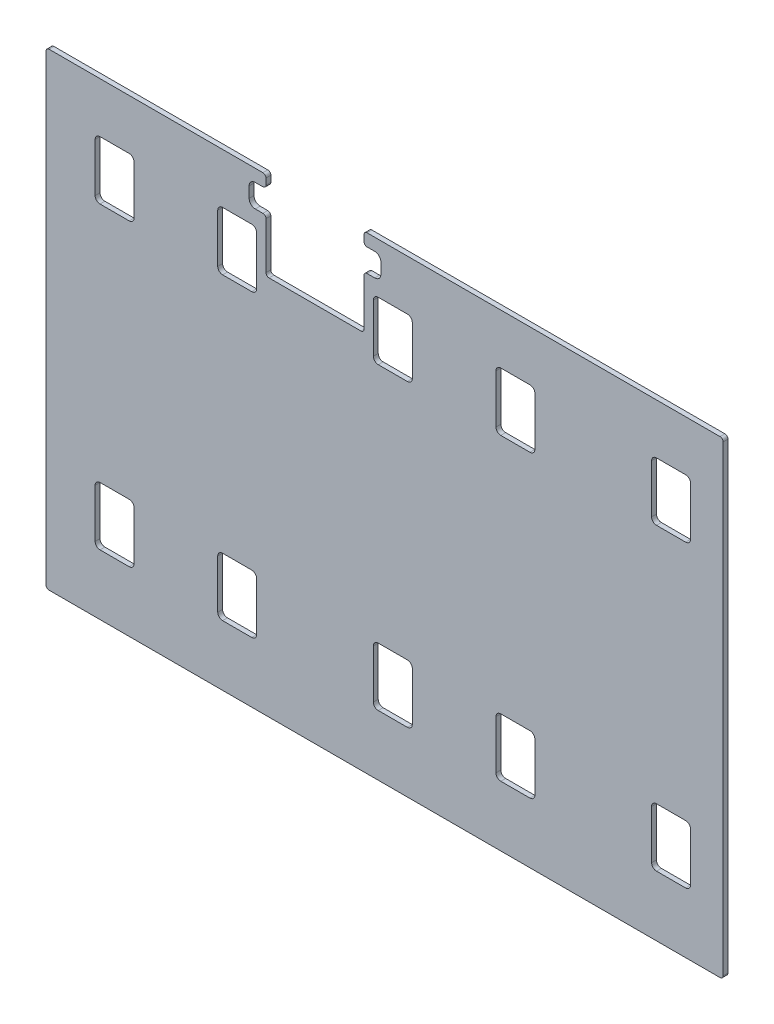
from build123d import *

# Parameters (mm, degrees)
SKETCH1_W           = 441.979400076
SKETCH1_H           = 305.81676
BOSS_EXTRUDE1_DEPTH = 3.175
CUT_EXTRUDE1_DEPTH  = 271.654843319
CUT_EXTRUDE2_DEPTH  = 271.654843319
LPATTERN1_COUNT     = 3
LPATTERN1_PITCH     = 181.613999992
LPATTERN2_COUNT     = 2
LPATTERN2_PITCH     = 181.613999992
CUT_EXTRUDE3_DEPTH  = 271.654843319
FILLET1_R           = 2


with BuildPart() as part:
    # Sketch1 → Boss-Extrude1 (new body)
    with BuildSketch(Plane.XY):
        with Locations((0, -3.32067)):
            Rectangle(SKETCH1_W, SKETCH1_H)
    extrude(amount=BOSS_EXTRUDE1_DEPTH)

    # Sketch2 → Cut-Extrude1 (cut, through all)
    with BuildSketch(Plane.XY.offset(3.175)):
        with BuildLine():
            Line((-166.696625, 116.8), (-185.746625, 116.8))
            ThreePointArc((-185.746625, 116.8), (-187.99168903, 115.87006403), (-188.921625, 113.625))
            Line((-188.921625, 113.625), (-188.921625, 81.875))
            ThreePointArc((-188.921625, 81.875), (-187.99168903, 79.62993597), (-185.746625, 78.7))
            Line((-185.746625, 78.7), (-166.696625, 78.7))
            ThreePointArc((-166.696625, 78.7), (-164.45156097, 79.62993597), (-163.521625, 81.875))
            Line((-163.521625, 81.875), (-163.521625, 113.625))
            ThreePointArc((-163.521625, 113.625), (-164.45156097, 115.87006403), (-166.696625, 116.8))
        make_face()
        with BuildLine():
            Line((-166.696625, -78.7), (-185.746625, -78.7))
            ThreePointArc((-185.746625, -78.7), (-187.99168903, -79.62993597), (-188.921625, -81.875))
            Line((-188.921625, -81.875), (-188.921625, -113.625))
            ThreePointArc((-188.921625, -113.625), (-187.99168903, -115.87006403), (-185.746625, -116.8))
            Line((-185.746625, -116.8), (-166.696625, -116.8))
            ThreePointArc((-166.696625, -116.8), (-164.45156097, -115.87006403), (-163.521625, -113.625))
            Line((-163.521625, -113.625), (-163.521625, -81.875))
            ThreePointArc((-163.521625, -81.875), (-164.45156097, -79.62993597), (-166.696625, -78.7))
        make_face()
    cut_extrude1 = extrude(amount=-CUT_EXTRUDE1_DEPTH, mode=Mode.SUBTRACT)

    # Sketch3 → Cut-Extrude2 (cut, through all)
    with BuildSketch(Plane.XY.offset(3.175)):
        with BuildLine():
            ThreePointArc((-83.506375, 113.625), (-84.43631097, 115.87006403), (-86.681375, 116.8))
            Line((-86.681375, 116.8), (-105.731375, 116.8))
            ThreePointArc((-105.731375, 116.8), (-107.97643903, 115.87006403), (-108.906375, 113.625))
            Line((-108.906375, 113.625), (-108.906375, 81.875))
            ThreePointArc((-108.906375, 81.875), (-107.97643903, 79.62993597), (-105.731375, 78.7))
            Line((-105.731375, 78.7), (-86.681375, 78.7))
            ThreePointArc((-86.681375, 78.7), (-84.43631097, 79.62993597), (-83.506375, 81.875))
            Line((-83.506375, 81.875), (-83.506375, 113.625))
        make_face()
        with BuildLine():
            ThreePointArc((-108.906375, -113.625), (-107.97643903, -115.87006403), (-105.731375, -116.8))
            Line((-105.731375, -116.8), (-86.681375, -116.8))
            ThreePointArc((-86.681375, -116.8), (-84.43631097, -115.87006403), (-83.506375, -113.625))
            Line((-83.506375, -113.625), (-83.506375, -81.875))
            ThreePointArc((-83.506375, -81.875), (-84.43631097, -79.62993597), (-86.681375, -78.7))
            Line((-86.681375, -78.7), (-105.731375, -78.7))
            ThreePointArc((-105.731375, -78.7), (-107.97643903, -79.62993597), (-108.906375, -81.875))
            Line((-108.906375, -81.875), (-108.906375, -113.625))
        make_face()
    cut_extrude2 = extrude(amount=-CUT_EXTRUDE2_DEPTH, mode=Mode.SUBTRACT)

    # LPattern1: Cut-Extrude1 ×3
    with Locations(*[(i * LPATTERN1_PITCH, 0, 0) for i in range(1, LPATTERN1_COUNT)]):
        add(cut_extrude1, mode=Mode.SUBTRACT)

    # LPattern2: Cut-Extrude2 ×2
    with Locations(*[(i * LPATTERN2_PITCH, 0, 0) for i in range(1, LPATTERN2_COUNT)]):
        add(cut_extrude2, mode=Mode.SUBTRACT)

    # Sketch6 → Cut-Extrude3 (cut, through all)
    with BuildSketch(Plane.XY.offset(3.175)):
        with BuildLine():
            Line((-77.407000004, 92.08771), (-13.407000004, 92.08771))
            Line((-13.407000004, 92.08771), (-13.407000004, 126.58771))
            Line((-13.407000004, 126.58771), (-6.407000004, 126.58771))
            ThreePointArc((-6.407000004, 126.58771), (-3.578572879, 127.759282875), (-2.407000004, 130.58771))
            Line((-2.407000004, 130.58771), (-2.407000004, 137.58771))
            ThreePointArc((-2.407000004, 137.58771), (-3.578572879, 140.416137125), (-6.407000004, 141.58771))
            Line((-6.407000004, 141.58771), (-13.407000004, 141.58771))
            Line((-13.407000004, 141.58771), (-13.407000004, 149.58771))
            Line((-13.407000004, 149.58771), (-77.407000004, 149.58771))
            Line((-77.407000004, 149.58771), (-77.407000004, 141.58771))
            Line((-77.407000004, 141.58771), (-84.407000004, 141.58771))
            ThreePointArc((-84.407000004, 141.58771), (-87.235427129, 140.416137125), (-88.407000004, 137.58771))
            Line((-88.407000004, 137.58771), (-88.407000004, 130.58771))
            ThreePointArc((-88.407000004, 130.58771), (-87.235427129, 127.759282875), (-84.407000004, 126.58771))
            Line((-84.407000004, 126.58771), (-77.407000004, 126.58771))
            Line((-77.407000004, 126.58771), (-77.407000004, 92.08771))
        make_face()
    extrude(amount=-CUT_EXTRUDE3_DEPTH, mode=Mode.SUBTRACT)

    # Fillet1
    fillet1_edges = [part.edges().sort_by_distance(p)[0] for p in [
        (-13.407000004, 126.58771, 1.5875),
        (-13.407000004, 92.08771, 1.5875),
        (-77.407000004, 92.08771, 1.5875),
        (-77.407000004, 126.58771, 1.5875),
        (-13.407000004, 141.58771, 1.5875),
        (-77.407000004, 141.58771, 1.5875),
        (-13.407000004, 149.58771, 1.5875),
        (-77.407000004, 149.58771, 1.5875),
        (220.989700038, 149.58771, 1.5875),
        (-220.989700038, 149.58771, 1.5875),
        (-220.989700038, -156.22905, 1.5875),
        (220.989700038, -156.22905, 1.5875),
    ]]
    fillet(fillet1_edges, radius=FILLET1_R)


solid = part.part
